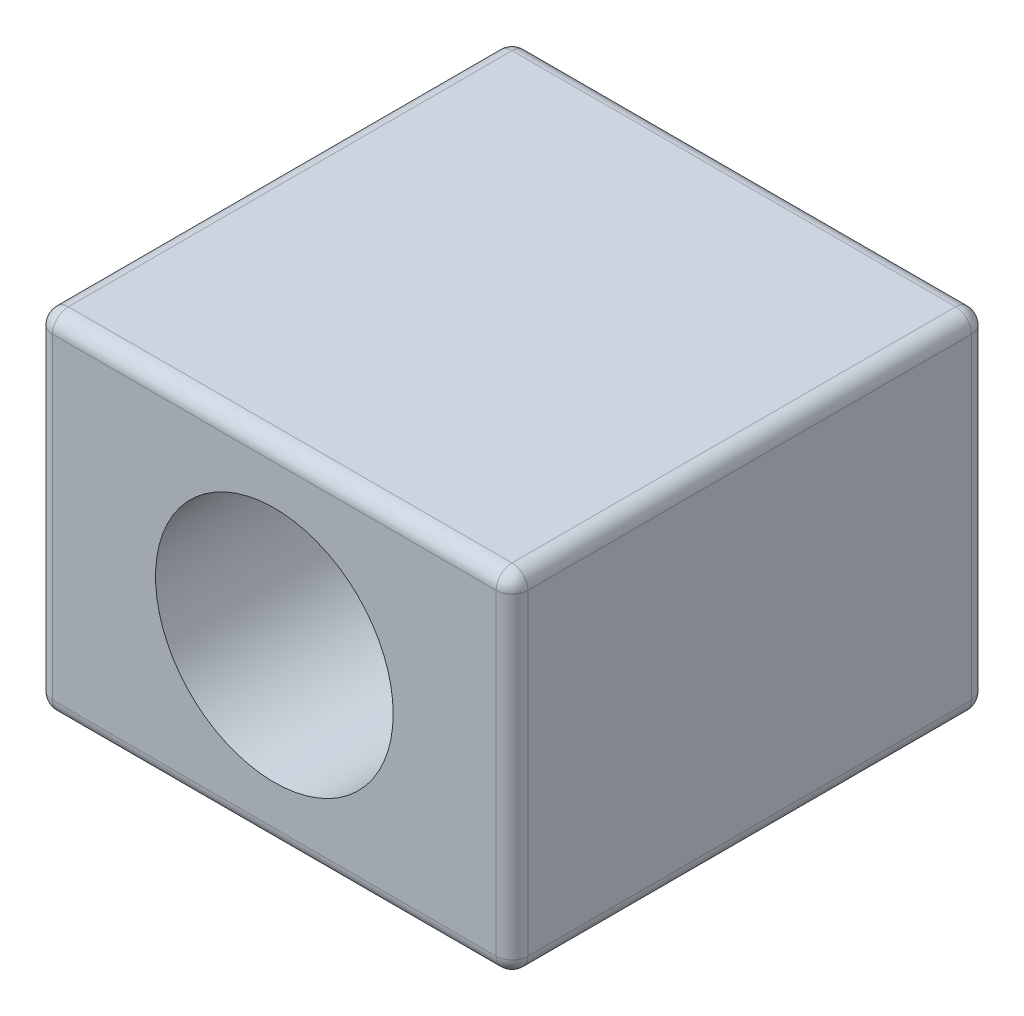
from build123d import *

# Parameters (mm, degrees)
SKETCH1_W           = 15
SKETCH1_H           = 11
SKETCH1_R           = 3.75
BOSS_EXTRUDE1_DEPTH = 7.5
FILLET1_R           = 0.5


with BuildPart() as part:
    # Sketch1 → Boss-Extrude1 (new, symmetric)
    with BuildSketch(Plane.XY):
        Rectangle(SKETCH1_W, SKETCH1_H)
        Circle(SKETCH1_R, mode=Mode.SUBTRACT)
    extrude(amount=BOSS_EXTRUDE1_DEPTH, both=True)

    # Fillet1
    fillet1_edges = [part.edges().sort_by_distance(p)[0] for p in [
        (7.5, 0, 7.5),
        (0, 5.5, 7.5),
        (-7.5, 0, 7.5),
        (0, 5.5, -7.5),
        (7.5, 0, -7.5),
        (0, -5.5, -7.5),
        (-7.5, 0, -7.5),
        (0, -5.5, 7.5),
        (-7.5, 5.5, 0),
        (7.5, 5.5, 0),
        (7.5, -5.5, 0),
        (-7.5, -5.5, 0),
    ]]
    fillet(fillet1_edges, radius=FILLET1_R)


solid = part.part
